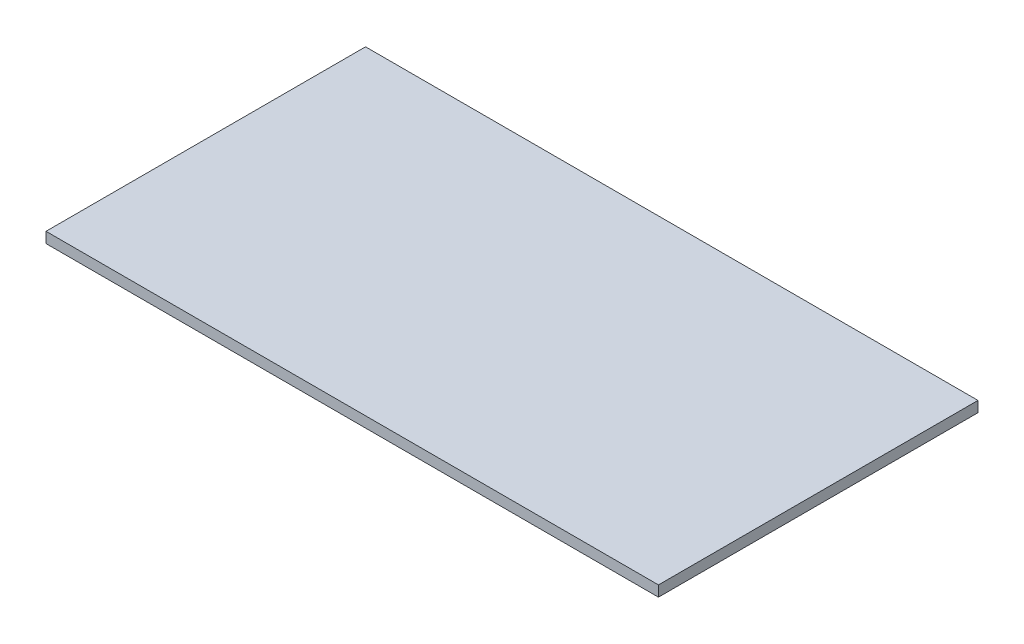
from build123d import *

# Parameters (mm, degrees)
SKETCH1_W           = 1150
SKETCH1_H           = 600
BOSS_EXTRUDE1_DEPTH = 20


with BuildPart() as part:
    # Sketch1 → Boss-Extrude1 (new body)
    with BuildSketch(Plane(origin=(0, 0, 0), x_dir=(1, 0, 0), z_dir=(0, 1, 0))):
        Rectangle(SKETCH1_W, SKETCH1_H)
    extrude(amount=BOSS_EXTRUDE1_DEPTH)


solid = part.part
